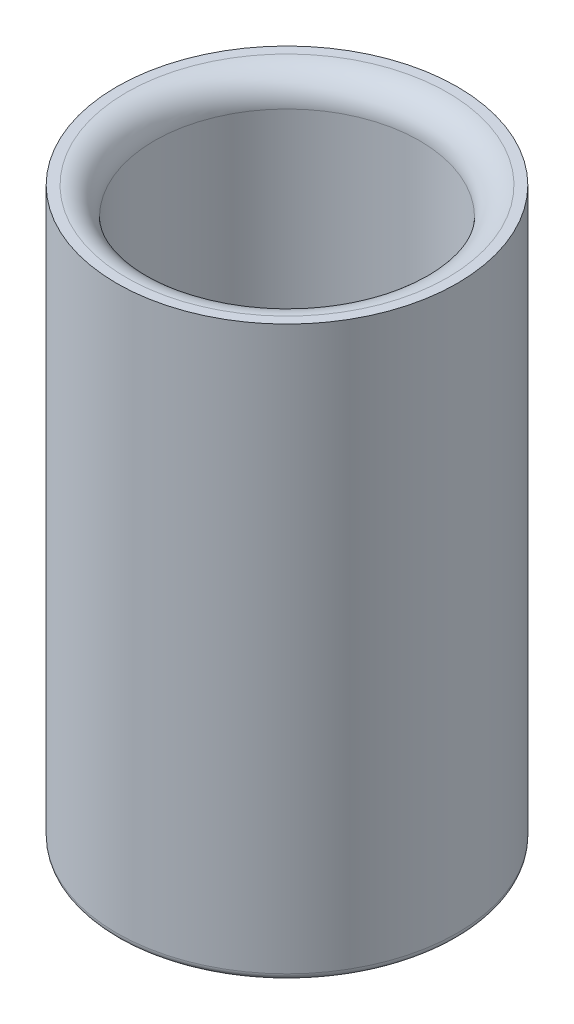
from build123d import *


with BuildPart() as part:
    # Szkic1 → Obrót1 (revolve)
    with BuildSketch(Plane.XY):
        with BuildLine():
            Line((0, -46.223602563), (-11.54, -46.223602563))
            Line((-11.54, -46.223602563), (-18.107155743, -45.649050884))
            ThreePointArc((-18.107155743, -45.649050884), (-18.757277337, -45.328446393), (-19.02, -44.652856186))
            Line((-19.02, -44.652856186), (-19.02, 22.516397437))
            ThreePointArc((-19.02, 22.516397437), (-20.191572875, 25.344824562), (-23.02, 26.516397437))
            Line((-23.02, 26.516397437), (-24.42, 26.516397437))
            Line((-24.42, 26.516397437), (-24.425, 26.516397437))
            Line((-24.425, 26.516397437), (-24.425, -54.183602563))
            ThreePointArc((-24.425, -54.183602563), (-24.132106781, -54.890709344), (-23.425, -55.183602563))
            Line((-23.425, -55.183602563), (0, -55.183602563))
            Line((0, -55.183602563), (0, -46.223602563))
        make_face()
    revolve(axis=Axis((0, 49.541128149, 0), (0, -1, 0)))


solid = part.part
